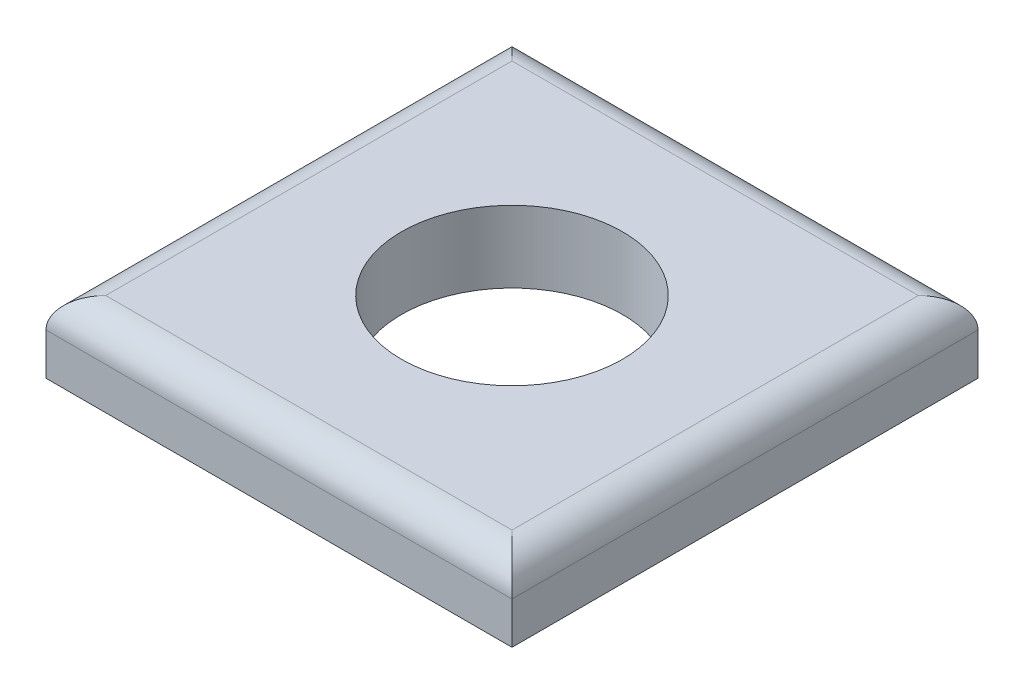
from build123d import *

# Parameters (mm, degrees)
SKETCH_1_W          = 7.8
SKETCH_1_H          = 7.8
EXTRUDE_1_DEPTH     = 1.2
SKETCH_2_R          = 1.85
CUT_EXTRUDE_1_DEPTH = 1.2
FILLET_1_R          = 0.5


with BuildPart() as part:
    # 草图1 → 拉伸1 (new body)
    with BuildSketch(Plane(origin=(0, 0, 0), x_dir=(1, 0, 0), z_dir=(0, 1, 0))):
        Rectangle(SKETCH_1_W, SKETCH_1_H)
    extrude(amount=EXTRUDE_1_DEPTH)

    # 草图2 → 切除-拉伸1 (cut)
    with BuildSketch(Plane(origin=(0, 1.2, 0), x_dir=(-1, 0, 0), z_dir=(0, 1, 0))):
        with Locations(Location((0, 0, 0), (0, 0, 90))):
            Circle(SKETCH_2_R)
    extrude(amount=-CUT_EXTRUDE_1_DEPTH, mode=Mode.SUBTRACT)

    # 圆角1
    fillet_1_edges = [part.edges().sort_by_distance(p)[0] for p in [
        (3.9, 1.2, 0),
        (0, 1.2, -3.9),
        (-3.9, 1.2, 0),
        (0, 1.2, 3.9),
    ]]
    fillet(fillet_1_edges, radius=FILLET_1_R)


solid = part.part
